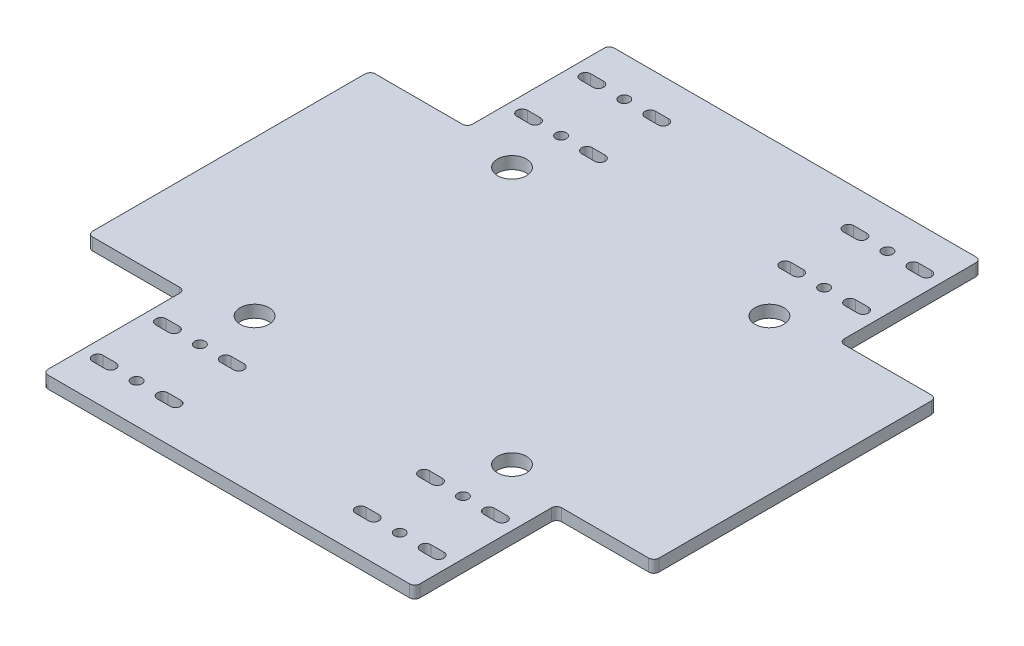
from build123d import *

# Parameters (mm, degrees)
SKETCH1_W           = 279.4
SKETCH1_H           = 279.4
BOSS_EXTRUDE1_DEPTH = 5.9944
SKETCH2_W           = 48
SKETCH2_H           = 70
CUT_EXTRUDE1_DEPTH  = 198.656552715
SKETCH3_R           = 2.6
CUT_EXTRUDE2_DEPTH  = 198.656552715
FILLET1_R           = 2.54
SKETCH4_R           = 7.125
CUT_EXTRUDE3_DEPTH  = 198.656552715


with BuildPart() as part:
    # Sketch1 → Boss-Extrude1 (new body)
    with BuildSketch(Plane(origin=(0, 0, 0), x_dir=(1, 0, 0), z_dir=(0, 1, 0))):
        Rectangle(SKETCH1_W, SKETCH1_H)
    extrude(amount=BOSS_EXTRUDE1_DEPTH)

    # Sketch2 → Cut-Extrude1 (cut, through all)
    with BuildSketch(Plane(origin=(0, 5.9944, 0), x_dir=(1, 0, 0), z_dir=(0, 1, 0))):
        with Locations((-115.7, 104.7)):
            Rectangle(SKETCH2_W, SKETCH2_H)
        with Locations((115.7, 104.7)):
            Rectangle(SKETCH2_W, SKETCH2_H)
        with Locations((-115.7, -104.7)):
            Rectangle(SKETCH2_W, SKETCH2_H)
        with Locations((115.7, -104.7)):
            Rectangle(SKETCH2_W, SKETCH2_H)
    extrude(amount=-CUT_EXTRUDE1_DEPTH, mode=Mode.SUBTRACT)

    # Sketch3 → Cut-Extrude2 (cut, through all)
    with BuildSketch(Plane(origin=(0, 5.9944, 0), x_dir=(1, 0, 0), z_dir=(0, 1, 0))):
        with Locations(Location((-64.9, 120.3, 0), (0, 0, 270))):
            Circle(SKETCH3_R)
        with Locations(Location((-64.9, 89.1, 0), (0, 0, 270))):
            Circle(SKETCH3_R)
        with Locations(Location((64.9, 89.1, 0), (0, 0, 270))):
            Circle(SKETCH3_R)
        with Locations(Location((64.9, 120.3, 0), (0, 0, 270))):
            Circle(SKETCH3_R)
        with Locations(Location((64.9, -120.3, 0), (0, 0, 270))):
            Circle(SKETCH3_R)
        with Locations(Location((64.9, -89.1, 0), (0, 0, 270))):
            Circle(SKETCH3_R)
        with Locations(Location((-64.9, -89.1, 0), (0, 0, 270))):
            Circle(SKETCH3_R)
        with Locations(Location((-64.9, -120.3, 0), (0, 0, 270))):
            Circle(SKETCH3_R)
        with BuildLine():
            Line((-84.1, 122.9), (-77.7, 122.9))
            ThreePointArc((-77.7, 122.9), (-75.1, 120.3), (-77.7, 117.7))
            Line((-77.7, 117.7), (-84.1, 117.7))
            ThreePointArc((-84.1, 117.7), (-86.7, 120.3), (-84.1, 122.9))
        make_face()
        with BuildLine():
            Line((-52.1, 122.9), (-45.7, 122.9))
            ThreePointArc((-45.7, 122.9), (-43.1, 120.3), (-45.7, 117.7))
            Line((-45.7, 117.7), (-52.1, 117.7))
            ThreePointArc((-52.1, 117.7), (-54.7, 120.3), (-52.1, 122.9))
        make_face()
        with BuildLine():
            Line((-84.1, 91.7), (-77.7, 91.7))
            ThreePointArc((-77.7, 91.7), (-75.1, 89.1), (-77.7, 86.5))
            Line((-77.7, 86.5), (-84.1, 86.5))
            ThreePointArc((-84.1, 86.5), (-86.7, 89.1), (-84.1, 91.7))
        make_face()
        with BuildLine():
            Line((-52.1, 91.7), (-45.7, 91.7))
            ThreePointArc((-45.7, 91.7), (-43.1, 89.1), (-45.7, 86.5))
            Line((-45.7, 86.5), (-52.1, 86.5))
            ThreePointArc((-52.1, 86.5), (-54.7, 89.1), (-52.1, 91.7))
        make_face()
        with BuildLine():
            Line((52.1, 91.7), (45.7, 91.7))
            ThreePointArc((45.7, 91.7), (43.1, 89.1), (45.7, 86.5))
            Line((45.7, 86.5), (52.1, 86.5))
            ThreePointArc((52.1, 86.5), (54.7, 89.1), (52.1, 91.7))
        make_face()
        with BuildLine():
            Line((84.1, 91.7), (77.7, 91.7))
            ThreePointArc((77.7, 91.7), (75.1, 89.1), (77.7, 86.5))
            Line((77.7, 86.5), (84.1, 86.5))
            ThreePointArc((84.1, 86.5), (86.7, 89.1), (84.1, 91.7))
        make_face()
        with BuildLine():
            Line((52.1, 122.9), (45.7, 122.9))
            ThreePointArc((45.7, 122.9), (43.1, 120.3), (45.7, 117.7))
            Line((45.7, 117.7), (52.1, 117.7))
            ThreePointArc((52.1, 117.7), (54.7, 120.3), (52.1, 122.9))
        make_face()
        with BuildLine():
            Line((84.1, 122.9), (77.7, 122.9))
            ThreePointArc((77.7, 122.9), (75.1, 120.3), (77.7, 117.7))
            Line((77.7, 117.7), (84.1, 117.7))
            ThreePointArc((84.1, 117.7), (86.7, 120.3), (84.1, 122.9))
        make_face()
        with BuildLine():
            Line((-84.1, -122.9), (-77.7, -122.9))
            ThreePointArc((-77.7, -122.9), (-75.1, -120.3), (-77.7, -117.7))
            Line((-77.7, -117.7), (-84.1, -117.7))
            ThreePointArc((-84.1, -117.7), (-86.7, -120.3), (-84.1, -122.9))
        make_face()
        with BuildLine():
            Line((-52.1, -122.9), (-45.7, -122.9))
            ThreePointArc((-45.7, -122.9), (-43.1, -120.3), (-45.7, -117.7))
            Line((-45.7, -117.7), (-52.1, -117.7))
            ThreePointArc((-52.1, -117.7), (-54.7, -120.3), (-52.1, -122.9))
        make_face()
        with BuildLine():
            Line((-84.1, -91.7), (-77.7, -91.7))
            ThreePointArc((-77.7, -91.7), (-75.1, -89.1), (-77.7, -86.5))
            Line((-77.7, -86.5), (-84.1, -86.5))
            ThreePointArc((-84.1, -86.5), (-86.7, -89.1), (-84.1, -91.7))
        make_face()
        with BuildLine():
            Line((-52.1, -91.7), (-45.7, -91.7))
            ThreePointArc((-45.7, -91.7), (-43.1, -89.1), (-45.7, -86.5))
            Line((-45.7, -86.5), (-52.1, -86.5))
            ThreePointArc((-52.1, -86.5), (-54.7, -89.1), (-52.1, -91.7))
        make_face()
        with BuildLine():
            Line((52.1, -91.7), (45.7, -91.7))
            ThreePointArc((45.7, -91.7), (43.1, -89.1), (45.7, -86.5))
            Line((45.7, -86.5), (52.1, -86.5))
            ThreePointArc((52.1, -86.5), (54.7, -89.1), (52.1, -91.7))
        make_face()
        with BuildLine():
            Line((84.1, -91.7), (77.7, -91.7))
            ThreePointArc((77.7, -91.7), (75.1, -89.1), (77.7, -86.5))
            Line((77.7, -86.5), (84.1, -86.5))
            ThreePointArc((84.1, -86.5), (86.7, -89.1), (84.1, -91.7))
        make_face()
        with BuildLine():
            Line((52.1, -122.9), (45.7, -122.9))
            ThreePointArc((45.7, -122.9), (43.1, -120.3), (45.7, -117.7))
            Line((45.7, -117.7), (52.1, -117.7))
            ThreePointArc((52.1, -117.7), (54.7, -120.3), (52.1, -122.9))
        make_face()
        with BuildLine():
            Line((84.1, -122.9), (77.7, -122.9))
            ThreePointArc((77.7, -122.9), (75.1, -120.3), (77.7, -117.7))
            Line((77.7, -117.7), (84.1, -117.7))
            ThreePointArc((84.1, -117.7), (86.7, -120.3), (84.1, -122.9))
        make_face()
    extrude(amount=-CUT_EXTRUDE2_DEPTH, mode=Mode.SUBTRACT)

    # Fillet1
    fillet1_edges = [part.edges().sort_by_distance(p)[0] for p in [
        (139.7, 2.9972, -69.7),
        (91.7, 2.9972, -69.7),
        (91.7, 2.9972, -139.7),
        (-139.7, 2.9972, 69.7),
        (-91.7, 2.9972, 69.7),
        (-91.7, 2.9972, 139.7),
        (139.7, 2.9972, 69.7),
        (91.7, 2.9972, 139.7),
        (91.7, 2.9972, 69.7),
        (-139.7, 2.9972, -69.7),
        (-91.7, 2.9972, -139.7),
        (-91.7, 2.9972, -69.7),
    ]]
    fillet(fillet1_edges, radius=FILLET1_R)

    # Sketch4 → Cut-Extrude3 (cut, through all)
    with BuildSketch(Plane(origin=(0, 5.9944, 0), x_dir=(1, 0, 0), z_dir=(0, 1, 0))):
        with Locations(Location((-63.5, 63.5, 0), (0, 0, 270))):
            Circle(SKETCH4_R)
        with Locations(Location((-63.5, -63.5, 0), (0, 0, 270))):
            Circle(SKETCH4_R)
        with Locations(Location((63.5, 63.5, 0), (0, 0, 270))):
            Circle(SKETCH4_R)
        with Locations(Location((63.5, -63.5, 0), (0, 0, 270))):
            Circle(SKETCH4_R)
    extrude(amount=-CUT_EXTRUDE3_DEPTH, mode=Mode.SUBTRACT)


solid = part.part
